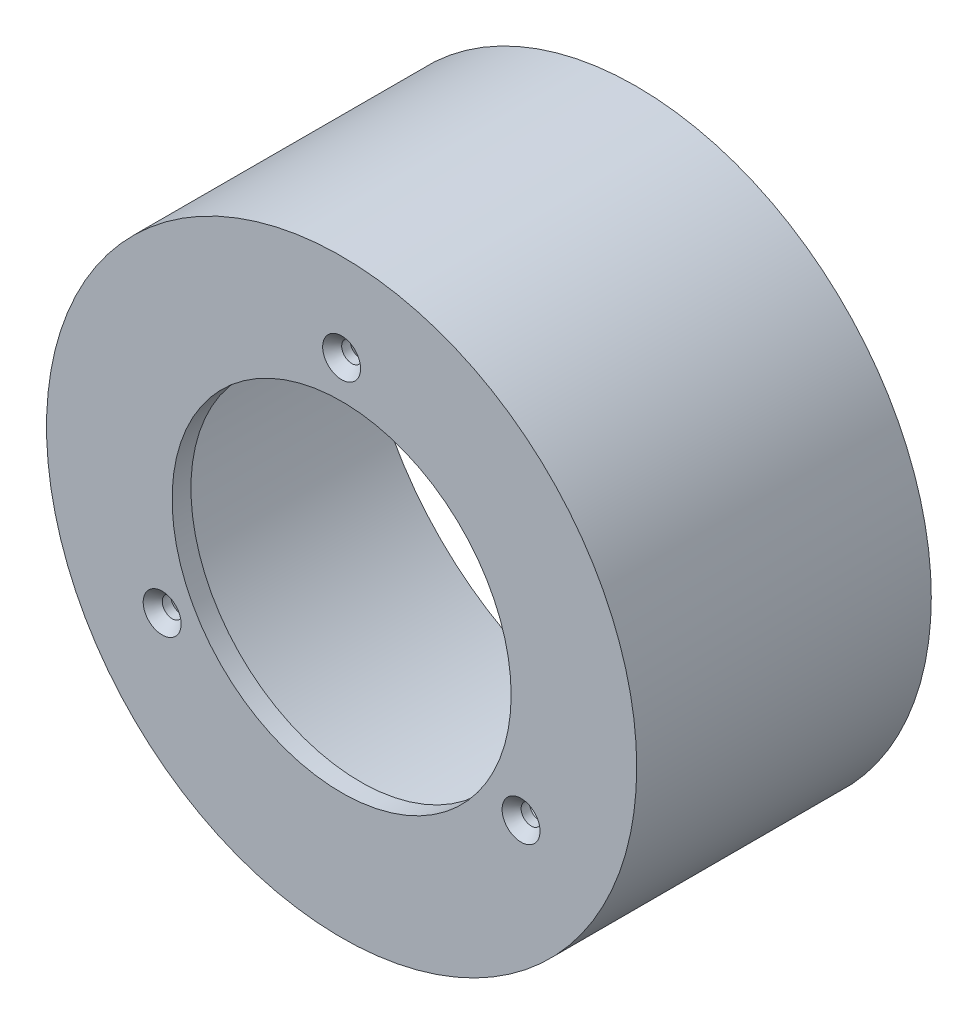
from build123d import *

# Parameters (mm, degrees)
SKETCH1_R                                      = 20.5
SKETCH1_R_2                                    = 1.5875
SKETCH1_R_3                                    = 13.5
EXTRUDE1_DEPTH                                 = 1.5
BOSS_EXTRUDE3_START                            = -1.5
SKETCH4_R                                      = 23.5
SKETCH4_R_2                                    = 20.5
BOSS_EXTRUDE3_DEPTH                            = 1.5
BOSS_EXTRUDE5_START                            = 21.9577
SKETCH5_R                                      = 23.5
SKETCH5_R_2                                    = 22
BOSS_EXTRUDE5_DEPTH                            = 21.9577
CSK_FOR_0_FLAT_HEAD_MACHINE_SCREW1_D           = 1.6129
CSK_FOR_0_FLAT_HEAD_MACHINE_SCREW1_CSINK_D     = 3.0226
CSK_FOR_0_FLAT_HEAD_MACHINE_SCREW1_CSINK_ANGLE = 82


with BuildPart() as part:
    # Sketch1 → Extrude1 (new body)
    # profile 1 of 4: a face of its own
    with BuildSketch(Plane.XY):
        Circle(SKETCH1_R)
        with Locations((-14.289419162, -8.25)):
            Circle(SKETCH1_R_2, mode=Mode.SUBTRACT)
        with Locations((14.289419162, -8.25)):
            Circle(SKETCH1_R_2, mode=Mode.SUBTRACT)
        with Locations((0, 16.5)):
            Circle(SKETCH1_R_2, mode=Mode.SUBTRACT)
        Circle(SKETCH1_R_3, mode=Mode.SUBTRACT)
    # profile 2 of 4: a face of its own
    with BuildSketch(Plane.XY):
        with Locations((14.289419162, -8.25)):
            Circle(SKETCH1_R_2)
    # profile 3 of 4: a face of its own
    with BuildSketch(Plane.XY):
        with Locations((0, 16.5)):
            Circle(SKETCH1_R_2)
    # profile 4 of 4: a face of its own
    with BuildSketch(Plane.XY):
        with Locations((-14.289419162, -8.25)):
            Circle(SKETCH1_R_2)
    extrude(amount=EXTRUDE1_DEPTH)

    # Sketch4 → Boss-Extrude3 (add)
    with BuildSketch(Plane.XY.offset(1.5).offset(BOSS_EXTRUDE3_START)):
        Circle(SKETCH4_R)
        Circle(SKETCH4_R_2, mode=Mode.SUBTRACT)
    extrude(amount=BOSS_EXTRUDE3_DEPTH)

    # Sketch5 → Boss-Extrude5 (add)
    with BuildSketch(Plane(origin=(0, 0, 0), x_dir=(-1, 0, 0), z_dir=(0, 0, -1)).offset(BOSS_EXTRUDE5_START)):
        with Locations(Location((0, 0, 0), (0, 0, 180))):
            Circle(SKETCH5_R)
        Circle(SKETCH5_R_2, mode=Mode.SUBTRACT)
    extrude(amount=-BOSS_EXTRUDE5_DEPTH)

    # CSK for #0 Flat Head Machine Screw1 (through all)
    with Locations(Plane(origin=(0, 16.5, 1.5), x_dir=(1, 0, 0), z_dir=(0, 0, 1))):
        with Locations((0, 0), (14.289419162, -24.75), (-14.289419162, -24.75)):
            CounterSinkHole(CSK_FOR_0_FLAT_HEAD_MACHINE_SCREW1_D / 2, CSK_FOR_0_FLAT_HEAD_MACHINE_SCREW1_CSINK_D / 2, counter_sink_angle=CSK_FOR_0_FLAT_HEAD_MACHINE_SCREW1_CSINK_ANGLE)


solid = part.part
